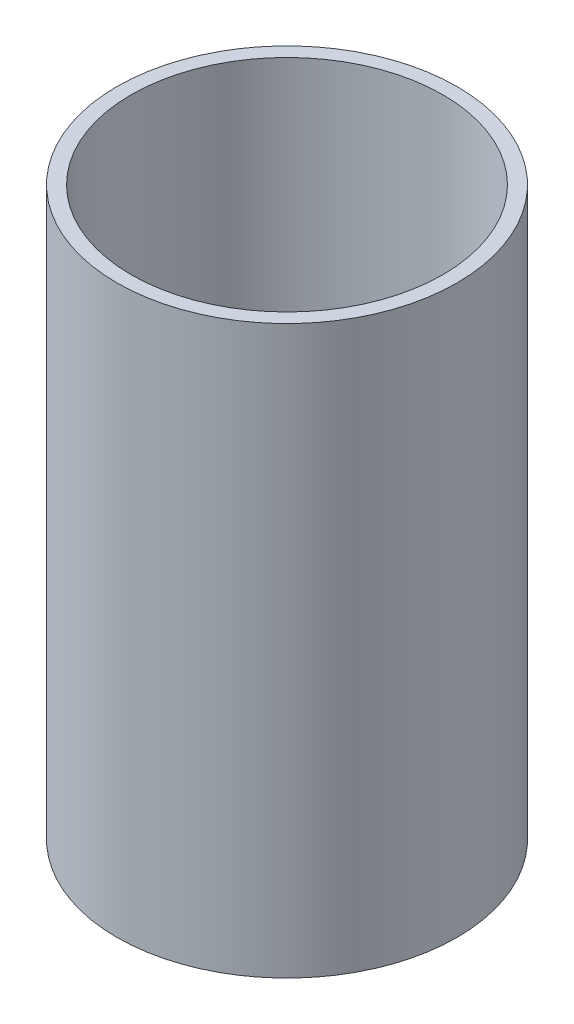
from build123d import *

# Parameters (mm, degrees)
SKETCH2_R           = 38.1
BOSS_EXTRUDE1_DEPTH = 127
SKETCH3_R           = 34.925
CUT_EXTRUDE1_DEPTH  = 127


with BuildPart() as part:
    # Sketch2 → Boss-Extrude1 (new body)
    with BuildSketch(Plane(origin=(0, 0, 0), x_dir=(1, 0, 0), z_dir=(0, 1, 0))):
        with Locations(Location((0, 0, 0), (0, 0, 270))):
            Circle(SKETCH2_R)
    extrude(amount=BOSS_EXTRUDE1_DEPTH)

    # Sketch3 → Cut-Extrude1 (cut)
    with BuildSketch(Plane(origin=(0, 127, 0), x_dir=(1, 0, 0), z_dir=(0, 1, 0))):
        with Locations(Location((0, 0, 0), (0, 0, 270))):
            Circle(SKETCH3_R)
    extrude(amount=-CUT_EXTRUDE1_DEPTH, mode=Mode.SUBTRACT)


solid = part.part
